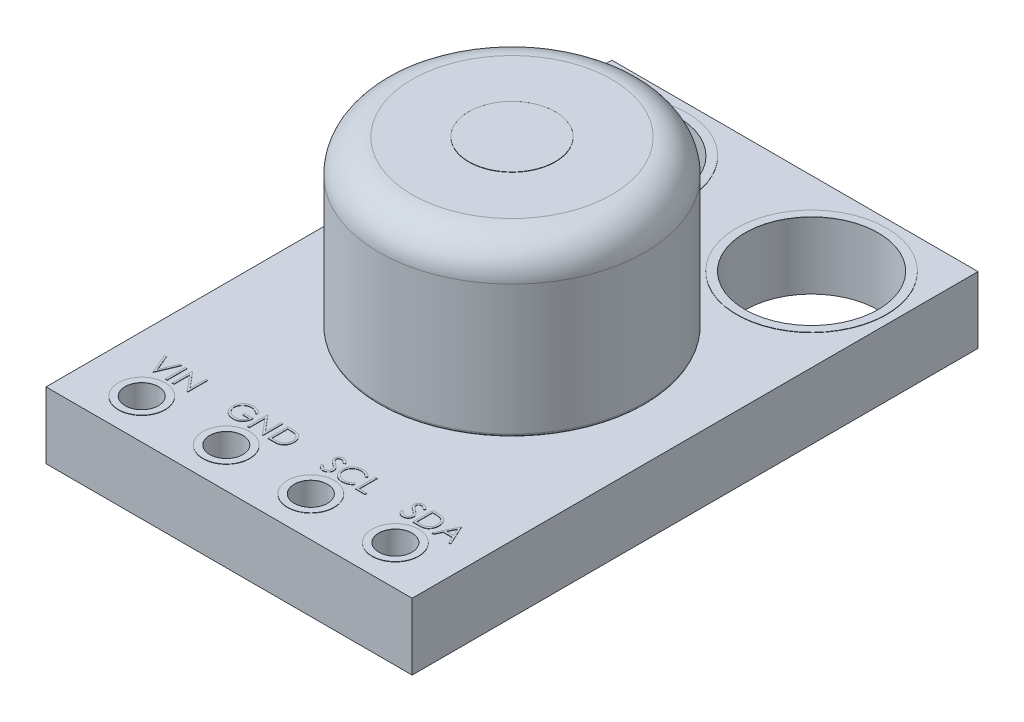
from build123d import *

# Parameters (mm, degrees)
ESBO_O1_W                   = 11
ESBO_O1_H                   = 17
RESSALTO_EXTRUS_O1_DEPTH    = 2
ESBO_O2_R                   = 4
RESSALTO_EXTRUS_O2_DEPTH    = 5
FILETE1_R                   = 1
ESBO_O4_R                   = 1.3
RESSALTO_EXTRUS_O3_DEPTH    = 0.01
ESBO_O5_R                   = 0.7
RESSALTO_EXTRUS_O4_DEPTH    = 0.01
RESSALTO_EXTRUS_O4_2_DEPTH  = 0.01
RESSALTO_EXTRUS_O4_3_DEPTH  = 0.01
RESSALTO_EXTRUS_O4_4_DEPTH  = 0.01
ESBO_O5_R_2                 = 2.25
RESSALTO_EXTRUS_O4_5_DEPTH  = 0.01
RESSALTO_EXTRUS_O4_6_DEPTH  = 0.01
CORTE_EXTRUS_O2_DEPTH       = 25
CORTE_EXTRUS_O2_DEPTH_BACK  = 25
ESBO_O3_R                   = 0.5
ESBO_O3_R_2                 = 2
FILETE3_R                   = 0.1
FILETE4_R                   = 0.001
RESSALTO_EXTRUS_O5_DEPTH    = 0.01
ESBO_O6_W                   = 0.053846154
ESBO_O6_H                   = 0.6
RESSALTO_EXTRUS_O5_2_DEPTH  = 0.01
RESSALTO_EXTRUS_O5_3_DEPTH  = 0.01
RESSALTO_EXTRUS_O5_4_DEPTH  = 0.01
RESSALTO_EXTRUS_O5_5_DEPTH  = 0.01
RESSALTO_EXTRUS_O5_6_DEPTH  = 0.01
RESSALTO_EXTRUS_O5_7_DEPTH  = 0.01
RESSALTO_EXTRUS_O5_8_DEPTH  = 0.01
RESSALTO_EXTRUS_O5_9_DEPTH  = 0.01
RESSALTO_EXTRUS_O5_10_DEPTH = 0.01
RESSALTO_EXTRUS_O5_11_DEPTH = 0.01
RESSALTO_EXTRUS_O5_12_DEPTH = 0.01


with BuildPart() as part:
    # Esboço1 → Ressalto-extrusão1 (new body)
    with BuildSketch(Plane(origin=(0, 0, 0), x_dir=(1, 0, 0), z_dir=(0, 1, 0))):
        with Locations((-7.947204127, -24.039923997)):
            Rectangle(ESBO_O1_W, ESBO_O1_H)
    extrude(amount=RESSALTO_EXTRUS_O1_DEPTH)


with BuildPart() as body_2:
    # Esboço2 → Ressalto-extrusão2 (new body)
    with BuildSketch(Plane(origin=(0, 2, 0), x_dir=(1, 0, 0), z_dir=(0, 1, 0))):
        with Locations(Location((-7.947204127, -24.039923997, 0), (0, 0, 270))):
            Circle(ESBO_O2_R)
    extrude(amount=RESSALTO_EXTRUS_O2_DEPTH)

    # Filete1
    filete1_edges = [body_2.edges().sort_by_distance(p)[0] for p in [
        (-7.947204127, 7, 20.039923997),
    ]]
    fillet(filete1_edges, radius=FILETE1_R)

    # Filete3
    filete3_edges = [body_2.edges().sort_by_distance(p)[0] for p in [
        (-7.947204127, 2, 20.039923997),
    ]]
    fillet(filete3_edges, radius=FILETE3_R)


with BuildPart() as body_3:
    # Esboço4 → Ressalto-extrusão3 (new body)
    with BuildSketch(Plane(origin=(0, 7, 0), x_dir=(1, 0, 0), z_dir=(0, 1, 0))):
        with Locations(Location((-7.947204127, -24.039923997, 0), (0, 0, 90))):
            Circle(ESBO_O4_R)
    extrude(amount=RESSALTO_EXTRUS_O3_DEPTH)

    # Filete4
    filete4_edges = [body_3.edges().sort_by_distance(p)[0] for p in [
        (-7.947204127, 7.01, 25.339923997),
    ]]
    fillet(filete4_edges, radius=FILETE4_R)


with BuildPart() as body_4:
    # Esboço5 → Ressalto-extrusão4 (new body)
    with BuildSketch(Plane(origin=(0, 2, 0), x_dir=(1, 0, 0), z_dir=(0, 1, 0))):
        with Locations(Location((-11.757204127, -31.353461523, 0), (0, 0, 90))):
            Circle(ESBO_O5_R)
    extrude(amount=RESSALTO_EXTRUS_O4_DEPTH)


with BuildPart() as body_5:
    # Esboço5 → Ressalto-extrus_o4 2 (new body)
    with BuildSketch(Plane(origin=(0, 2, 0), x_dir=(1, 0, 0), z_dir=(0, 1, 0))):
        with Locations(Location((-9.217204127, -31.353461523, 0), (0, 0, 90))):
            Circle(ESBO_O5_R)
    extrude(amount=RESSALTO_EXTRUS_O4_2_DEPTH)


with BuildPart() as body_6:
    # Esboço5 → Ressalto-extrus_o4 3 (new body)
    with BuildSketch(Plane(origin=(0, 2, 0), x_dir=(1, 0, 0), z_dir=(0, 1, 0))):
        with Locations(Location((-6.677204127, -31.353461523, 0), (0, 0, 90))):
            Circle(ESBO_O5_R)
    extrude(amount=RESSALTO_EXTRUS_O4_3_DEPTH)


with BuildPart() as body_7:
    # Esboço5 → Ressalto-extrus_o4 4 (new body)
    with BuildSketch(Plane(origin=(0, 2, 0), x_dir=(1, 0, 0), z_dir=(0, 1, 0))):
        with Locations(Location((-4.137204127, -31.353461523, 0), (0, 0, 90))):
            Circle(ESBO_O5_R)
    extrude(amount=RESSALTO_EXTRUS_O4_4_DEPTH)


with BuildPart() as body_8:
    # Esboço5 → Ressalto-extrus_o4 5 (new body)
    with BuildSketch(Plane(origin=(0, 2, 0), x_dir=(1, 0, 0), z_dir=(0, 1, 0))):
        with Locations(Location((-10.947204127, -18.039923997, 0), (0, 0, 90))):
            Circle(ESBO_O5_R_2)
    extrude(amount=RESSALTO_EXTRUS_O4_5_DEPTH)


with BuildPart() as body_9:
    # Esboço5 → Ressalto-extrus_o4 6 (new body)
    with BuildSketch(Plane(origin=(0, 2, 0), x_dir=(1, 0, 0), z_dir=(0, 1, 0))):
        with Locations(Location((-4.947204127, -18.039923997, 0), (0, 0, 90))):
            Circle(ESBO_O5_R_2)
    extrude(amount=RESSALTO_EXTRUS_O4_6_DEPTH)


with BuildPart() as corte_extrus_o2_tool:
    # Esboço3 → Corte-extrusão2 (new, two sides: drawn at the far end of the back side and taken through both)
    with BuildSketch(Plane(origin=(0, 2, 0), x_dir=(1, 0, 0), z_dir=(0, 1, 0)).offset(-CORTE_EXTRUS_O2_DEPTH_BACK)):
        with Locations(Location((-11.757204127, -31.353461523, 0), (0, 0, 270))):
            Circle(ESBO_O3_R)
        with Locations(Location((-9.217204127, -31.353461523, 0), (0, 0, 270))):
            Circle(ESBO_O3_R)
        with Locations(Location((-6.677204127, -31.353461523, 0), (0, 0, 270))):
            Circle(ESBO_O3_R)
        with Locations(Location((-4.137204127, -31.353461523, 0), (0, 0, 270))):
            Circle(ESBO_O3_R)
        with Locations(Location((-10.947204127, -18.039923997, 0), (0, 0, 270))):
            Circle(ESBO_O3_R_2)
        with Locations(Location((-4.947204127, -18.039923997, 0), (0, 0, 270))):
            Circle(ESBO_O3_R_2)
    extrude(amount=CORTE_EXTRUS_O2_DEPTH + CORTE_EXTRUS_O2_DEPTH_BACK)


with BuildPart() as part_1:
    add(part.part)

    # Corte-extrusão2: cut by corte_extrus_o2_tool
    add(corte_extrus_o2_tool.part, mode=Mode.SUBTRACT)


with BuildPart() as body_4_1:
    add(body_4.part)

    # Corte-extrusão2: cut by corte_extrus_o2_tool
    add(corte_extrus_o2_tool.part, mode=Mode.SUBTRACT)


with BuildPart() as body_5_1:
    add(body_5.part)

    # Corte-extrusão2: cut by corte_extrus_o2_tool
    add(corte_extrus_o2_tool.part, mode=Mode.SUBTRACT)


with BuildPart() as body_6_1:
    add(body_6.part)

    # Corte-extrusão2: cut by corte_extrus_o2_tool
    add(corte_extrus_o2_tool.part, mode=Mode.SUBTRACT)


with BuildPart() as body_7_1:
    add(body_7.part)

    # Corte-extrusão2: cut by corte_extrus_o2_tool
    add(corte_extrus_o2_tool.part, mode=Mode.SUBTRACT)


with BuildPart() as body_8_1:
    add(body_8.part)

    # Corte-extrusão2: cut by corte_extrus_o2_tool
    add(corte_extrus_o2_tool.part, mode=Mode.SUBTRACT)


with BuildPart() as body_9_1:
    add(body_9.part)

    # Corte-extrusão2: cut by corte_extrus_o2_tool
    add(corte_extrus_o2_tool.part, mode=Mode.SUBTRACT)


with BuildPart() as body_10:
    # Esboço6 → Ressalto-extrusão5 (new body)
    with BuildSketch(Plane(origin=(0, 2, 0), x_dir=(1, 0, 0), z_dir=(0, 1, 0))):
        Polygon((-12.47271802, -29.953006455), (-12.415025712, -29.953006455), (-12.215025712, -30.425842993), (-12.015025712, -29.953006455), (-11.957333405, -29.953006455), (-12.211179559, -30.553006455), (-12.218871866, -30.553006455), align=None)
    extrude(amount=RESSALTO_EXTRUS_O5_DEPTH)


with BuildPart() as body_11:
    # Esboço6 → Ressalto-extrus_o5 2 (new body)
    with BuildSketch(Plane(origin=(0, 2, 0), x_dir=(1, 0, 0), z_dir=(0, 1, 0))):
        with Locations((-11.82271802, -30.253006455)):
            Rectangle(ESBO_O6_W, ESBO_O6_H)
    extrude(amount=RESSALTO_EXTRUS_O5_2_DEPTH)


with BuildPart() as body_12:
    # Esboço6 → Ressalto-extrus_o5 3 (new body)
    with BuildSketch(Plane(origin=(0, 2, 0), x_dir=(1, 0, 0), z_dir=(0, 1, 0))):
        Polygon((-11.641948789, -30.553006455), (-11.641948789, -29.953006455), (-11.630650712, -29.953006455), (-11.234256482, -30.425242032), (-11.234256482, -29.953006455), (-11.180410328, -29.953006455), (-11.180410328, -30.553006455), (-11.192669943, -30.553006455), (-11.588102635, -30.081852609), (-11.588102635, -30.553006455), align=None)
    extrude(amount=RESSALTO_EXTRUS_O5_3_DEPTH)


with BuildPart() as body_13:
    # Esboço6 → Ressalto-extrus_o5 4 (new body)
    with BuildSketch(Plane(origin=(0, 2, 0), x_dir=(1, 0, 0), z_dir=(0, 1, 0))):
        with BuildLine():
            Line((-9.541948789, -30.055410301), (-9.588102635, -30.099160301))
            add(Edge.make_bspline(
                [(-9.588102635, -30.099160301), (-9.596454445, -30.091303582), (-9.61295891, -30.075777491), (-9.63986638, -30.055632749), (-9.667940146, -30.038375703), (-9.697033717, -30.024334634), (-9.726426612, -30.013131304), (-9.755728688, -30.005155051), (-9.784639379, -30.00006833), (-9.803868045, -29.999460038), (-9.81334302, -29.999160301)],
                knots=[0, 0, 0, 0, 1.08915593, 2.152340314, 3.188132944, 4.216796309, 5.218260357, 6.173443236, 7.099959455, 8, 8, 8, 8], degree=3))
            add(Edge.make_bspline(
                [(-9.81334302, -29.999160301), (-9.819156969, -29.999231205), (-9.830769787, -29.999372829), (-9.848019263, -30.001180408), (-9.86508783, -30.003780099), (-9.881943265, -30.007541564), (-9.898618343, -30.012308832), (-9.915055067, -30.018272054), (-9.931284099, -30.025224381), (-9.94715257, -30.033257948), (-9.962536657, -30.042083065), (-9.9770664, -30.051862815), (-9.990834411, -30.06228375), (-10.003581913, -30.073606775), (-10.015382231, -30.085729323), (-10.026516237, -30.09842589), (-10.036592345, -30.112043356), (-10.045693688, -30.126331178), (-10.053812822, -30.14103841), (-10.06098002, -30.156023494), (-10.066996664, -30.171236726), (-10.071757142, -30.186697197), (-10.075684682, -30.202285298), (-10.078447701, -30.218108964), (-10.080005424, -30.234185139), (-10.080274872, -30.244950383), (-10.080410328, -30.250362224)],
                knots=[0, 0, 0, 0, 1.02818874, 2.053710826, 3.065248034, 4.081641283, 5.106893873, 6.131558223, 7.173050175, 8.228653731, 9.27666206, 10.308777013, 11.325269123, 12.329503258, 13.32196095, 14.316845687, 15.314881793, 16.315733098, 17.311955233, 18.285320748, 19.252783886, 20.203351036, 21.145449891, 22.095197417, 23.042428769, 24, 24, 24, 24], degree=3))
            add(Edge.make_bspline(
                [(-10.080410328, -30.250362224), (-10.080280776, -30.255894364), (-10.080022026, -30.266943538), (-10.078365972, -30.28343395), (-10.075292559, -30.299679448), (-10.071183809, -30.315733414), (-10.066044241, -30.331623342), (-10.059637498, -30.347280343), (-10.052049109, -30.362703839), (-10.0432657, -30.377754859), (-10.03363378, -30.392415949), (-10.022843537, -30.406226153), (-10.011381723, -30.419369372), (-9.998830769, -30.431553788), (-9.985593133, -30.443105313), (-9.971273314, -30.453705688), (-9.956152892, -30.463559098), (-9.940208799, -30.472541359), (-9.923614036, -30.480565679), (-9.906598593, -30.487701204), (-9.88910811, -30.493577662), (-9.871234506, -30.498367051), (-9.852999088, -30.502292816), (-9.834309293, -30.504818384), (-9.815302543, -30.506651098), (-9.802490206, -30.506785099), (-9.796035328, -30.506852609)],
                knots=[0, 0, 0, 0, 0.93586088, 1.869166235, 2.799637598, 3.729985548, 4.670839027, 5.622275134, 6.589130586, 7.576015415, 8.568469353, 9.55398029, 10.53834874, 11.515998671, 12.510579167, 13.508179873, 14.527009472, 15.561807829, 16.601455013, 17.643573243, 18.680854198, 19.719860599, 20.772568776, 21.833555941, 22.908541556, 24, 24, 24, 24], degree=3))
            add(Edge.make_bspline(
                [(-9.796035328, -30.506852609), (-9.788256183, -30.506689996), (-9.772980567, -30.506370678), (-9.750525748, -30.503884914), (-9.728959508, -30.500002607), (-9.708342444, -30.494317025), (-9.688650612, -30.487064966), (-9.669811822, -30.4783229), (-9.651974395, -30.467755518), (-9.635084708, -30.45582857), (-9.619526333, -30.442540313), (-9.605494198, -30.428201263), (-9.593212114, -30.412881023), (-9.582497023, -30.396669826), (-9.573632682, -30.379433488), (-9.566356774, -30.361256478), (-9.560779638, -30.342130618), (-9.558490214, -30.32891491), (-9.557333405, -30.322237224)],
                knots=[0, 0, 0, 0, 1.13008108, 2.219097802, 3.278683437, 4.311054135, 5.322181354, 6.324827112, 7.324222904, 8.330512327, 9.32562643, 10.293043162, 11.24128371, 12.174520618, 13.111833804, 14.052305215, 15.015860969, 16, 16, 16, 16], degree=3))
            Line((-9.557333405, -30.322237224), (-9.757333405, -30.322237224))
            Line((-9.757333405, -30.322237224), (-9.757333405, -30.260698763))
            Line((-9.757333405, -30.260698763), (-9.503487251, -30.260698763))
            add(Edge.make_bspline(
                [(-9.503487251, -30.260698763), (-9.503779682, -30.272168618), (-9.504352023, -30.294617196), (-9.508366694, -30.327354957), (-9.514849525, -30.358275819), (-9.523705578, -30.387412345), (-9.535169912, -30.414723247), (-9.549119488, -30.440236253), (-9.565777566, -30.463786541), (-9.584550784, -30.48556637), (-9.605619349, -30.504994235), (-9.628413969, -30.522069538), (-9.652972307, -30.536452844), (-9.679271131, -30.548154672), (-9.707224348, -30.557287357), (-9.736896642, -30.563762484), (-9.768247773, -30.567641906), (-9.789734061, -30.568137571), (-9.800722828, -30.56839107)],
                knots=[0, 0, 0, 0, 1.140356446, 2.231883559, 3.274166699, 4.278491846, 5.25512956, 6.21435461, 7.1637429, 8.11826594, 9.068280886, 10.0076534, 10.945064095, 11.891975133, 12.864533718, 13.863980011, 14.907571808, 16, 16, 16, 16], degree=3))
            add(Edge.make_bspline(
                [(-9.800722828, -30.56839107), (-9.807495994, -30.568293507), (-9.82085486, -30.56810108), (-9.840584734, -30.566733534), (-9.859770611, -30.564628293), (-9.878409699, -30.561449129), (-9.896570557, -30.557555188), (-9.914162486, -30.552568893), (-9.931252499, -30.546797116), (-9.947867011, -30.540232144), (-9.963855219, -30.532625574), (-9.979288336, -30.524172493), (-9.994251672, -30.514916488), (-10.0086433, -30.504697486), (-10.022538207, -30.493591921), (-10.035846797, -30.481577535), (-10.048643576, -30.468691058), (-10.056659656, -30.45954037), (-10.060698789, -30.454929532)],
                knots=[0, 0, 0, 0, 1.107784379, 2.184907829, 3.233506516, 4.263428166, 5.276301166, 6.270063455, 7.25232949, 8.225834625, 9.190232166, 10.146266622, 11.1027726, 12.066435141, 13.031522626, 14.010570082, 14.99756817, 16, 16, 16, 16], degree=3))
            add(Edge.make_bspline(
                [(-10.060698789, -30.454929532), (-10.066559235, -30.447614563), (-10.078182848, -30.433106045), (-10.093144818, -30.409860341), (-10.105899344, -30.38579145), (-10.116248114, -30.360832371), (-10.124328929, -30.335006449), (-10.130124286, -30.308346685), (-10.133519822, -30.280818748), (-10.134008999, -30.262190417), (-10.134256482, -30.25276607)],
                knots=[0, 0, 0, 0, 1.023165419, 2.029347347, 3.013907458, 3.994755782, 4.975994455, 5.96558838, 6.970761222, 8, 8, 8, 8], degree=3))
            add(Edge.make_bspline(
                [(-10.134256482, -30.25276607), (-10.134165241, -30.245708998), (-10.133983919, -30.231684546), (-10.131785259, -30.210863293), (-10.12863073, -30.190411746), (-10.123994092, -30.170346622), (-10.118149018, -30.15065452), (-10.110854135, -30.131326298), (-10.102360724, -30.112350548), (-10.092488925, -30.093857885), (-10.081503017, -30.0760937), (-10.069580123, -30.059129505), (-10.056550934, -30.043274237), (-10.042628225, -30.028327098), (-10.027645884, -30.014475867), (-10.011744269, -30.001592305), (-9.994911124, -29.98965913), (-9.977093493, -29.978864301), (-9.958557319, -29.969167681), (-9.939347033, -29.960666673), (-9.9194685, -29.953640962), (-9.899070646, -29.947679742), (-9.877999075, -29.943271432), (-9.856406697, -29.940074505), (-9.834180964, -29.937886973), (-9.819157644, -29.937711044), (-9.811540135, -29.937621839)],
                knots=[0, 0, 0, 0, 1.008945113, 2.00506715, 2.99143336, 3.967273523, 4.948097931, 5.927297278, 6.919902385, 7.919676788, 8.923139349, 9.905703106, 10.883022732, 11.856032218, 12.825136022, 13.798837087, 14.781400844, 15.773989409, 16.776158564, 17.77167057, 18.775803737, 19.789618931, 20.80898985, 21.851988756, 22.910860228, 24, 24, 24, 24], degree=3))
            add(Edge.make_bspline(
                [(-9.811540135, -29.937621839), (-9.805327865, -29.937721181), (-9.793009663, -29.937918163), (-9.774679538, -29.939283532), (-9.756632735, -29.941447625), (-9.738842497, -29.944400789), (-9.721369405, -29.948423136), (-9.704163684, -29.953236556), (-9.687200393, -29.958840868), (-9.670532693, -29.965524671), (-9.654048513, -29.973111006), (-9.637656197, -29.98165045), (-9.621411755, -29.991289022), (-9.605287015, -30.002055343), (-9.589180297, -30.0137645), (-9.573346358, -30.026751384), (-9.557402996, -30.040503857), (-9.547151257, -30.050392231), (-9.541948789, -30.055410301)],
                knots=[0, 0, 0, 0, 0.985871117, 1.954866573, 2.915460327, 3.869826059, 4.81536089, 5.759505086, 6.70452669, 7.649098992, 8.607881297, 9.583363685, 10.581137262, 11.603961102, 12.659522466, 13.73993555, 14.853081303, 16, 16, 16, 16], degree=3))
        make_face()
    extrude(amount=RESSALTO_EXTRUS_O5_4_DEPTH)


with BuildPart() as body_14:
    # Esboço6 → Ressalto-extrus_o5 5 (new body)
    with BuildSketch(Plane(origin=(0, 2, 0), x_dir=(1, 0, 0), z_dir=(0, 1, 0))):
        Polygon((-9.380410328, -30.553006455), (-9.380410328, -29.953006455), (-9.369112251, -29.953006455), (-8.97271802, -30.425242032), (-8.97271802, -29.953006455), (-8.918871866, -29.953006455), (-8.918871866, -30.553006455), (-8.931131482, -30.553006455), (-9.326564174, -30.081852609), (-9.326564174, -30.553006455), align=None)
    extrude(amount=RESSALTO_EXTRUS_O5_5_DEPTH)


with BuildPart() as body_15:
    # Esboço6 → Ressalto-extrus_o5 6 (new body)
    with BuildSketch(Plane(origin=(0, 2, 0), x_dir=(1, 0, 0), z_dir=(0, 1, 0))):
        with BuildLine():
            Line((-8.765025712, -30.553006455), (-8.765025712, -29.953006455))
            Line((-8.765025712, -29.953006455), (-8.643871866, -29.953006455))
            add(Edge.make_bspline(
                [(-8.643871866, -29.953006455), (-8.633334325, -29.953082324), (-8.612975851, -29.953228903), (-8.583556575, -29.954158284), (-8.556336501, -29.955802364), (-8.531405154, -29.95819714), (-8.508694089, -29.96113766), (-8.488266899, -29.964823443), (-8.47001796, -29.969175701), (-8.458794627, -29.97288635), (-8.453487251, -29.97464107)],
                knots=[0, 0, 0, 0, 1.314313732, 2.53924729, 3.670748893, 4.714932338, 5.66265055, 6.526160246, 7.303039223, 8, 8, 8, 8], degree=3))
            add(Edge.make_bspline(
                [(-8.453487251, -29.97464107), (-8.446545296, -29.977286334), (-8.432818805, -29.982516876), (-8.413274727, -29.99238367), (-8.394876094, -30.003563059), (-8.37752424, -30.016069779), (-8.361615527, -30.030257953), (-8.346528459, -30.045524882), (-8.332880221, -30.06242574), (-8.320381656, -30.080610024), (-8.309112686, -30.099863518), (-8.299317401, -30.120149537), (-8.291182431, -30.141365058), (-8.284429306, -30.163451084), (-8.279107057, -30.186456177), (-8.275475868, -30.210407125), (-8.273080841, -30.235209272), (-8.272840147, -30.25203918), (-8.27271802, -30.26057857)],
                knots=[0, 0, 0, 0, 0.984719456, 1.947108742, 2.898477687, 3.838006223, 4.779231079, 5.722358779, 6.681677486, 7.655904652, 8.64651281, 9.637519902, 10.640069247, 11.656948941, 12.698408672, 13.768548281, 14.867775369, 16, 16, 16, 16], degree=3))
            add(Edge.make_bspline(
                [(-8.27271802, -30.26057857), (-8.272825843, -30.267994783), (-8.27303832, -30.282609203), (-8.274946202, -30.304147643), (-8.277719286, -30.325047112), (-8.282012577, -30.345208089), (-8.287224436, -30.364807212), (-8.293904005, -30.383635597), (-8.301555804, -30.401865964), (-8.310478641, -30.419251817), (-8.320274307, -30.435723253), (-8.330786606, -30.451250486), (-8.342004325, -30.465611953), (-8.354034433, -30.478851143), (-8.36672147, -30.4909481), (-8.380148498, -30.502003874), (-8.394350164, -30.51180214), (-8.40926286, -30.52072793), (-8.425321625, -30.528514277), (-8.44283063, -30.535102278), (-8.461864546, -30.540561698), (-8.482376653, -30.545116709), (-8.504402392, -30.548729961), (-8.527963358, -30.551151628), (-8.55302335, -30.552789274), (-8.570231225, -30.552932655), (-8.579088212, -30.553006455)],
                knots=[0, 0, 0, 0, 1.105936401, 2.179363191, 3.223086493, 4.248585256, 5.251745608, 6.245858792, 7.225916811, 8.198733463, 9.158002045, 10.082870192, 10.993790845, 11.873723703, 12.748670949, 13.606408763, 14.465103618, 15.319838547, 16.196477973, 17.123216899, 18.106603292, 19.147568657, 20.255746949, 21.433717677, 22.679120308, 24, 24, 24, 24], degree=3))
            Line((-8.579088212, -30.553006455), (-8.765025712, -30.553006455))
        make_face()
        with BuildLine():
            Line((-8.711179559, -30.491467993), (-8.642309366, -30.491467993))
            add(Edge.make_bspline(
                [(-8.642309366, -30.491467993), (-8.632413074, -30.491425462), (-8.61337888, -30.49134366), (-8.586008938, -30.490625854), (-8.561001041, -30.48945295), (-8.53835164, -30.487811508), (-8.518073521, -30.485639746), (-8.500124307, -30.483218334), (-8.484562834, -30.480201628), (-8.475146359, -30.477467178), (-8.470794943, -30.47620357)],
                knots=[0, 0, 0, 0, 1.375205317, 2.645023457, 3.804390687, 4.853969522, 5.800190428, 6.637939096, 7.370582563, 8, 8, 8, 8], degree=3))
            add(Edge.make_bspline(
                [(-8.470794943, -30.47620357), (-8.465318081, -30.474274732), (-8.454495172, -30.470463125), (-8.438915557, -30.463510383), (-8.424385785, -30.455274599), (-8.410652638, -30.446119924), (-8.397910925, -30.435723466), (-8.386009648, -30.424311297), (-8.374972768, -30.411825336), (-8.364914315, -30.398281079), (-8.355912892, -30.383762829), (-8.348117824, -30.368413314), (-8.341286133, -30.352400718), (-8.335924088, -30.335479148), (-8.331721417, -30.317799881), (-8.328744613, -30.299361673), (-8.32689066, -30.280167968), (-8.326674412, -30.267113318), (-8.326564174, -30.260458378)],
                knots=[0, 0, 0, 0, 0.998632004, 1.973411704, 2.929992603, 3.868527914, 4.809262121, 5.754881198, 6.702106254, 7.672490631, 8.653608572, 9.636854334, 10.631411391, 11.644891563, 12.686317036, 13.754757253, 14.855430412, 16, 16, 16, 16], degree=3))
            add(Edge.make_bspline(
                [(-8.326564174, -30.260458378), (-8.326652166, -30.25344121), (-8.326825027, -30.239655921), (-8.328997766, -30.219428945), (-8.33217289, -30.199975119), (-8.336764379, -30.181293143), (-8.342615387, -30.163346568), (-8.349917326, -30.146234652), (-8.358260175, -30.129776674), (-8.368186461, -30.114352497), (-8.379057705, -30.099765107), (-8.391122485, -30.086401407), (-8.40418912, -30.074230956), (-8.418115094, -30.063064217), (-8.433292883, -30.053350444), (-8.449364944, -30.044661298), (-8.466567059, -30.037287146), (-8.47853495, -30.033365055), (-8.484617059, -30.031371839)],
                knots=[0, 0, 0, 0, 1.122418816, 2.205001699, 3.251619955, 4.274784885, 5.280384055, 6.268708349, 7.249350384, 8.229342522, 9.199999885, 10.157847722, 11.105861043, 12.055065948, 13.010012805, 13.98527497, 14.976112212, 16, 16, 16, 16], degree=3))
            add(Edge.make_bspline(
                [(-8.484617059, -30.031371839), (-8.489648684, -30.029980452), (-8.500347299, -30.02702198), (-8.517805493, -30.023794773), (-8.537453804, -30.020948288), (-8.559379467, -30.018538338), (-8.583557489, -30.016809083), (-8.610006464, -30.015511143), (-8.638737825, -30.014635721), (-8.658654831, -30.014575942), (-8.668992059, -30.014544916)],
                knots=[0, 0, 0, 0, 0.674548936, 1.434276114, 2.292660221, 3.240891867, 4.284742987, 5.42552168, 6.663806718, 8, 8, 8, 8], degree=3))
            Line((-8.668992059, -30.014544916), (-8.711179559, -30.014544916))
            Line((-8.711179559, -30.014544916), (-8.711179559, -30.491467993))
        make_face(mode=Mode.SUBTRACT)
    extrude(amount=RESSALTO_EXTRUS_O5_6_DEPTH)


with BuildPart() as body_16:
    # Esboço6 → Ressalto-extrus_o5 7 (new body)
    with BuildSketch(Plane(origin=(0, 2, 0), x_dir=(1, 0, 0), z_dir=(0, 1, 0))):
        with BuildLine():
            Line((-7.288102635, -30.437261263), (-7.237381482, -30.406852609))
            add(Edge.make_bspline(
                [(-7.237381482, -30.406852609), (-7.23266407, -30.41474936), (-7.22362569, -30.429879232), (-7.208548314, -30.450323467), (-7.192925529, -30.467699837), (-7.176641644, -30.481907256), (-7.159796053, -30.493092779), (-7.142278786, -30.501013162), (-7.124148876, -30.505953043), (-7.111810506, -30.506553058), (-7.105650712, -30.506852609)],
                knots=[0, 0, 0, 0, 1.272034388, 2.437168799, 3.508375237, 4.49857839, 5.41946034, 6.295179144, 7.148887113, 8, 8, 8, 8], degree=3))
            add(Edge.make_bspline(
                [(-7.105650712, -30.506852609), (-7.100390108, -30.506706093), (-7.089960947, -30.506415626), (-7.074607419, -30.503624632), (-7.059696253, -30.499336838), (-7.045534772, -30.493196107), (-7.032318381, -30.485766652), (-7.020728662, -30.476793022), (-7.010709328, -30.466746244), (-7.00251348, -30.455537789), (-6.996225474, -30.443483421), (-6.991392548, -30.4311104), (-6.988710536, -30.41822436), (-6.988306521, -30.409548281), (-6.988102635, -30.405169916)],
                knots=[0, 0, 0, 0, 1.095163259, 2.171163733, 3.241058638, 4.321873601, 5.38011039, 6.391990106, 7.366004449, 8.327778327, 9.272591725, 10.192022065, 11.087607919, 12, 12, 12, 12], degree=3))
            add(Edge.make_bspline(
                [(-6.988102635, -30.405169916), (-6.988355374, -30.400174342), (-6.988869156, -30.39001907), (-6.993211695, -30.375036272), (-7.000042995, -30.360208974), (-7.006345162, -30.351037329), (-7.009617059, -30.346275686)],
                knots=[0, 0, 0, 0, 0.938893495, 1.908633276, 2.914225137, 4, 4, 4, 4], degree=3))
            add(Edge.make_bspline(
                [(-7.009617059, -30.346275686), (-7.01230345, -30.342839087), (-7.017943191, -30.335624379), (-7.027638765, -30.324885196), (-7.039015813, -30.313807752), (-7.051684994, -30.301969057), (-7.066107809, -30.28991972), (-7.081832526, -30.277085158), (-7.099260616, -30.26395346), (-7.111483387, -30.255146734), (-7.117790135, -30.250602609)],
                knots=[0, 0, 0, 0, 0.722233717, 1.516239348, 2.393582979, 3.351407094, 4.387010283, 5.505090956, 6.712668013, 8, 8, 8, 8], degree=3))
            add(Edge.make_bspline(
                [(-7.117790135, -30.250602609), (-7.124102821, -30.246106279), (-7.136172194, -30.23750964), (-7.153050808, -30.224751191), (-7.168144144, -30.213086528), (-7.181385119, -30.20240584), (-7.192767907, -30.192707679), (-7.202382206, -30.184085176), (-7.209983101, -30.176305137), (-7.214209772, -30.171258049), (-7.216107443, -30.168992032)],
                knots=[0, 0, 0, 0, 1.452282411, 2.77665338, 3.964542531, 5.026858415, 5.96415736, 6.766646006, 7.446254459, 8, 8, 8, 8], degree=3))
            add(Edge.make_bspline(
                [(-7.216107443, -30.168992032), (-7.218759879, -30.165460425), (-7.223976251, -30.158515048), (-7.230861852, -30.147659358), (-7.23671428, -30.136546798), (-7.241302109, -30.125147507), (-7.245165461, -30.113621519), (-7.247763963, -30.101818448), (-7.24939106, -30.089791257), (-7.249557686, -30.081697514), (-7.249641097, -30.077645878)],
                knots=[0, 0, 0, 0, 1.068054152, 2.10047183, 3.106115577, 4.101338837, 5.06977816, 6.043150881, 7.020423561, 8, 8, 8, 8], degree=3))
            add(Edge.make_bspline(
                [(-7.249641097, -30.077645878), (-7.249417347, -30.071297917), (-7.248974629, -30.058737677), (-7.24523054, -30.040389535), (-7.239320902, -30.022871863), (-7.231041778, -30.006358092), (-7.220369089, -29.991278209), (-7.20801835, -29.977458754), (-7.19330781, -29.965841283), (-7.17716736, -29.955690644), (-7.159500554, -29.947745629), (-7.140987827, -29.941752318), (-7.121599758, -29.938356445), (-7.108467792, -29.937869114), (-7.101804559, -29.937621839)],
                knots=[0, 0, 0, 0, 1.005424448, 1.989358655, 2.955360095, 3.929531133, 4.905563448, 5.876582895, 6.856512386, 7.866279853, 8.892233794, 9.918561126, 10.94386622, 12, 12, 12, 12], degree=3))
            add(Edge.make_bspline(
                [(-7.101804559, -29.937621839), (-7.094734141, -29.937865705), (-7.080673338, -29.938350677), (-7.059990616, -29.942567397), (-7.04007735, -29.949544655), (-7.024058504, -29.95746271), (-7.01152146, -29.965370953), (-7.00196042, -29.972574352), (-6.992271714, -29.980867227), (-6.98237719, -29.990271669), (-6.972444506, -30.00087397), (-6.9623262, -30.012601516), (-6.951998611, -30.02538264), (-6.945354749, -30.03450684), (-6.941948789, -30.039184339)],
                knots=[0, 0, 0, 0, 1.286793592, 2.559021753, 3.825965368, 5.121522368, 5.803751409, 6.523245864, 7.299691795, 8.125521123, 9.008227632, 9.944561021, 10.946284179, 12, 12, 12, 12], degree=3))
            Line((-6.941948789, -30.039184339), (-6.990626674, -30.076083378))
            add(Edge.make_bspline(
                [(-6.990626674, -30.076083378), (-6.993565977, -30.072296745), (-6.999226386, -30.065004576), (-7.007820013, -30.054792351), (-7.015919781, -30.045463811), (-7.023899849, -30.037361218), (-7.031338758, -30.030040852), (-7.038558822, -30.023773465), (-7.045456139, -30.018497649), (-7.054150467, -30.012867324), (-7.065073504, -30.007286209), (-7.078785139, -30.00256351), (-7.093114215, -29.9997255), (-7.10287358, -29.999350262), (-7.107814174, -29.999160301)],
                knots=[0, 0, 0, 0, 1.181633172, 2.275549214, 3.290209073, 4.226197932, 5.078386478, 5.862611352, 6.581680152, 7.217281963, 8.414376989, 9.595101626, 10.782541182, 12, 12, 12, 12], degree=3))
            add(Edge.make_bspline(
                [(-7.107814174, -29.999160301), (-7.114012435, -29.999368021), (-7.125965197, -29.999768589), (-7.142934952, -30.004143444), (-7.158208196, -30.011031763), (-7.171331493, -30.020685759), (-7.182257832, -30.032123644), (-7.190161625, -30.045285733), (-7.194918796, -30.059819859), (-7.195499301, -30.069958429), (-7.195794943, -30.075121839)],
                knots=[0, 0, 0, 0, 1.14458467, 2.207223713, 3.21896685, 4.227309161, 5.202851033, 6.127160689, 7.046193047, 8, 8, 8, 8], degree=3))
            add(Edge.make_bspline(
                [(-7.195794943, -30.075121839), (-7.19572755, -30.078336379), (-7.195592654, -30.084770713), (-7.19371126, -30.094276671), (-7.191294232, -30.103758615), (-7.187464066, -30.113173915), (-7.1821763, -30.122687234), (-7.175232556, -30.132462389), (-7.166487416, -30.142585539), (-7.1597885, -30.14916966), (-7.156251674, -30.152645878)],
                knots=[0, 0, 0, 0, 0.858281714, 1.717966888, 2.583508476, 3.4729293, 4.427298488, 5.488583878, 6.674047936, 8, 8, 8, 8], degree=3))
            add(Edge.make_bspline(
                [(-7.156251674, -30.152645878), (-7.154938296, -30.153817939), (-7.15181801, -30.156602489), (-7.146113566, -30.161161166), (-7.138580514, -30.166784499), (-7.129415566, -30.173742324), (-7.118449732, -30.181813432), (-7.105681808, -30.190894623), (-7.091254117, -30.201280701), (-7.081016074, -30.208541994), (-7.075602635, -30.212381455)],
                knots=[0, 0, 0, 0, 0.420754252, 0.999615792, 1.744751191, 2.668019286, 3.750313428, 4.999500688, 6.413464383, 8, 8, 8, 8], degree=3))
            add(Edge.make_bspline(
                [(-7.075602635, -30.212381455), (-7.069090765, -30.217119974), (-7.056481429, -30.226295458), (-7.03854013, -30.240081004), (-7.02227262, -30.253563478), (-7.007621785, -30.266656782), (-6.994442886, -30.279261598), (-6.982882134, -30.291529572), (-6.972821732, -30.303372813), (-6.961991009, -30.318556683), (-6.950923954, -30.337204869), (-6.941419696, -30.360052567), (-6.935426836, -30.382989079), (-6.934643148, -30.398405108), (-6.934256482, -30.406011263)],
                knots=[0, 0, 0, 0, 1.163667725, 2.253281268, 3.268753668, 4.215851969, 5.092017293, 5.902905408, 6.650798638, 7.335211899, 8.59617414, 9.77448103, 10.901945474, 12, 12, 12, 12], degree=3))
            add(Edge.make_bspline(
                [(-6.934256482, -30.406011263), (-6.934369134, -30.411390411), (-6.934592251, -30.422044248), (-6.937156979, -30.437687975), (-6.940914636, -30.452881839), (-6.946578162, -30.46743803), (-6.953490703, -30.481622846), (-6.96226206, -30.4950642), (-6.972429091, -30.508059583), (-6.984092023, -30.520262467), (-6.996854177, -30.531464672), (-7.010342811, -30.541429654), (-7.02458, -30.54973851), (-7.039488512, -30.556518654), (-7.055071769, -30.561821543), (-7.071324532, -30.565663749), (-7.088273591, -30.568021871), (-7.099793674, -30.56826663), (-7.105650712, -30.56839107)],
                knots=[0, 0, 0, 0, 0.983748083, 1.948392443, 2.894712957, 3.844097841, 4.80183111, 5.778335162, 6.776009319, 7.81870978, 8.863265674, 9.881300176, 10.883814829, 11.87499822, 12.874611388, 13.892143829, 14.928324115, 16, 16, 16, 16], degree=3))
            add(Edge.make_bspline(
                [(-7.105650712, -30.56839107), (-7.110182485, -30.568303439), (-7.119188959, -30.56812928), (-7.132510584, -30.566589632), (-7.145563085, -30.564411272), (-7.158182676, -30.56095286), (-7.170531947, -30.556756807), (-7.182557187, -30.551590235), (-7.194264225, -30.545398715), (-7.205718668, -30.538319568), (-7.216891383, -30.530081097), (-7.227677578, -30.520485641), (-7.238431152, -30.50979784), (-7.248834706, -30.497727458), (-7.259098674, -30.484469501), (-7.269020687, -30.469899926), (-7.278806124, -30.454098094), (-7.284945919, -30.442978365), (-7.288102635, -30.437261263)],
                knots=[0, 0, 0, 0, 0.915332311, 1.819136955, 2.706846663, 3.586547465, 4.459518054, 5.340707479, 6.227863349, 7.133153174, 8.059268498, 9.028702269, 10.047606654, 11.120612155, 12.245963614, 13.433783089, 14.680604001, 16, 16, 16, 16], degree=3))
        make_face()
    extrude(amount=RESSALTO_EXTRUS_O5_7_DEPTH)


with BuildPart() as body_17:
    # Esboço6 → Ressalto-extrus_o5 8 (new body)
    with BuildSketch(Plane(origin=(0, 2, 0), x_dir=(1, 0, 0), z_dir=(0, 1, 0))):
        with BuildLine():
            Line((-6.257333405, -30.063102609), (-6.304448789, -30.099160301))
            add(Edge.make_bspline(
                [(-6.304448789, -30.099160301), (-6.307809799, -30.095154706), (-6.314486504, -30.087197521), (-6.325228081, -30.076023884), (-6.336422649, -30.065555554), (-6.348065927, -30.05574266), (-6.36036749, -30.046928358), (-6.373029341, -30.038653311), (-6.386263292, -30.031235985), (-6.404563589, -30.02224233), (-6.42850322, -30.012857275), (-6.458639479, -30.00498815), (-6.490098524, -29.999978805), (-6.51156097, -29.999436261), (-6.522477635, -29.999160301)],
                knots=[0, 0, 0, 0, 0.757959112, 1.505699292, 2.245454638, 2.979532153, 3.711538275, 4.438200793, 5.171680507, 5.909471876, 7.393775596, 8.890124382, 10.418191784, 12, 12, 12, 12], degree=3))
            add(Edge.make_bspline(
                [(-6.522477635, -29.999160301), (-6.528491915, -29.999229552), (-6.540464657, -29.99936741), (-6.558232967, -30.001186118), (-6.57566949, -30.003742325), (-6.592762884, -30.007535238), (-6.609491391, -30.012330544), (-6.625964374, -30.018060615), (-6.641943334, -30.025150016), (-6.657649318, -30.032985717), (-6.672697183, -30.041836137), (-6.686935191, -30.051489854), (-6.700311414, -30.061838842), (-6.712836433, -30.072921889), (-6.724523053, -30.084689082), (-6.735286592, -30.097265826), (-6.745089805, -30.110611913), (-6.754127009, -30.124551354), (-6.762220621, -30.139043547), (-6.768997172, -30.154142131), (-6.77499805, -30.169588549), (-6.779746491, -30.185557319), (-6.78350498, -30.201936079), (-6.786098294, -30.218768785), (-6.787896317, -30.236020273), (-6.78803349, -30.247713298), (-6.788102635, -30.253607416)],
                knots=[0, 0, 0, 0, 1.054917814, 2.100044995, 3.131103042, 4.146048494, 5.169673617, 6.183595914, 7.203665975, 8.234915748, 9.262203917, 10.264457458, 11.251630812, 12.227803204, 13.197192746, 14.159520551, 15.12972552, 16.100847026, 17.073214652, 18.039054194, 19.002613845, 19.979014051, 20.95965708, 21.949030935, 22.966165397, 24, 24, 24, 24], degree=3))
            add(Edge.make_bspline(
                [(-6.788102635, -30.253607416), (-6.787886324, -30.262475643), (-6.787461624, -30.279887229), (-6.78368191, -30.305390762), (-6.77793818, -30.329822877), (-6.769329795, -30.35303085), (-6.758715101, -30.375300855), (-6.745302424, -30.396256087), (-6.729768161, -30.416213212), (-6.711892546, -30.434700574), (-6.692280121, -30.451588642), (-6.671237621, -30.46646017), (-6.648817458, -30.478857007), (-6.625267178, -30.489172883), (-6.600405559, -30.497102608), (-6.574277307, -30.502685029), (-6.546939251, -30.506326546), (-6.528258782, -30.506675178), (-6.518751674, -30.506852609)],
                knots=[0, 0, 0, 0, 1.029171465, 2.020641659, 2.987623507, 3.938342917, 4.889210282, 5.84687017, 6.821220943, 7.821438502, 8.827599549, 9.822697543, 10.807740252, 11.797342354, 12.80366471, 13.83203677, 14.896651826, 16, 16, 16, 16], degree=3))
            add(Edge.make_bspline(
                [(-6.518751674, -30.506852609), (-6.508276927, -30.506563104), (-6.48766012, -30.505993288), (-6.457425601, -30.501165988), (-6.428482327, -30.493338917), (-6.400828741, -30.482384987), (-6.374542801, -30.468145224), (-6.349583374, -30.45088273), (-6.32592939, -30.430433302), (-6.311705742, -30.414819051), (-6.304448789, -30.406852609)],
                knots=[0, 0, 0, 0, 1.028121516, 2.023589091, 2.998037872, 3.967518031, 4.937445131, 5.927275754, 6.942489185, 8, 8, 8, 8], degree=3))
            Line((-6.304448789, -30.406852609), (-6.257333405, -30.442549724))
            add(Edge.make_bspline(
                [(-6.257333405, -30.442549724), (-6.261125081, -30.44744203), (-6.268690271, -30.457203208), (-6.280940216, -30.470964073), (-6.293844896, -30.483907622), (-6.307500161, -30.4959295), (-6.321748925, -30.507270265), (-6.336847036, -30.517607722), (-6.352596013, -30.527086159), (-6.368942495, -30.535765061), (-6.385869114, -30.54346516), (-6.403355589, -30.550057235), (-6.421326544, -30.555735787), (-6.439782803, -30.560407548), (-6.458762647, -30.564054019), (-6.478197585, -30.566491678), (-6.498129564, -30.56816172), (-6.511576665, -30.568313934), (-6.518391097, -30.56839107)],
                knots=[0, 0, 0, 0, 0.986787822, 1.968848986, 2.935600012, 3.899624008, 4.868462664, 5.837806735, 6.815139263, 7.798259679, 8.787526145, 9.778297419, 10.776456485, 11.791383307, 12.812564526, 13.85620153, 14.913611965, 16, 16, 16, 16], degree=3))
            add(Edge.make_bspline(
                [(-6.518391097, -30.56839107), (-6.524844297, -30.568346157), (-6.537604701, -30.568257347), (-6.556444487, -30.56681869), (-6.574785558, -30.564855878), (-6.592575494, -30.561900427), (-6.609911375, -30.558412826), (-6.626636047, -30.553737753), (-6.642914083, -30.548500753), (-6.658680084, -30.542345613), (-6.673947461, -30.535399981), (-6.688666972, -30.52755), (-6.702831846, -30.51886168), (-6.716581347, -30.509526536), (-6.729712361, -30.499244712), (-6.74233868, -30.488159004), (-6.754531104, -30.476306773), (-6.762074422, -30.467760227), (-6.765867059, -30.463463186)],
                knots=[0, 0, 0, 0, 1.114604814, 2.203992996, 3.262667896, 4.300477797, 5.318619304, 6.316056647, 7.298880507, 8.271930387, 9.238335007, 10.195173496, 11.151986948, 12.108099108, 13.064862484, 14.031167946, 15.010108607, 16, 16, 16, 16], degree=3))
            add(Edge.make_bspline(
                [(-6.765867059, -30.463463186), (-6.77194174, -30.455998982), (-6.784017765, -30.441160689), (-6.799467882, -30.417111663), (-6.812693177, -30.392002827), (-6.823386192, -30.365702268), (-6.831745518, -30.338269002), (-6.83753658, -30.309689199), (-6.841299712, -30.279989552), (-6.841730047, -30.25978896), (-6.841948789, -30.249520878)],
                knots=[0, 0, 0, 0, 0.994628077, 1.977248131, 2.950237994, 3.925870899, 4.908910175, 5.911660606, 6.938484602, 8, 8, 8, 8], degree=3))
            add(Edge.make_bspline(
                [(-6.841948789, -30.249520878), (-6.841682185, -30.238728514), (-6.841157657, -30.217495213), (-6.836701235, -30.186333964), (-6.829532298, -30.156479438), (-6.819349974, -30.127987368), (-6.806440486, -30.100707891), (-6.790493066, -30.074849399), (-6.771692985, -30.050246519), (-6.750187687, -30.027272562), (-6.726604716, -30.006265816), (-6.701350062, -29.987784752), (-6.674473157, -29.972404606), (-6.646270096, -29.959548121), (-6.616529694, -29.949666214), (-6.585315402, -29.942748524), (-6.552685874, -29.938442733), (-6.530423743, -29.937898412), (-6.519112251, -29.937621839)],
                knots=[0, 0, 0, 0, 1.032925535, 2.032216505, 3.007276963, 3.968222605, 4.92396291, 5.891752235, 6.871517503, 7.883894988, 8.900124299, 9.891468569, 10.874487609, 11.85992873, 12.854644235, 13.869047385, 14.917252991, 16, 16, 16, 16], degree=3))
            add(Edge.make_bspline(
                [(-6.519112251, -29.937621839), (-6.512218341, -29.937704492), (-6.498572542, -29.937868094), (-6.478386373, -29.939463432), (-6.458733403, -29.942122908), (-6.439600091, -29.945742805), (-6.420893357, -29.950235489), (-6.402756173, -29.956088111), (-6.385082112, -29.962780088), (-6.367982642, -29.970487254), (-6.351539805, -29.979138695), (-6.335758722, -29.988638516), (-6.320764746, -29.99897494), (-6.306452372, -30.010060056), (-6.293061022, -30.02212838), (-6.280210483, -30.034847968), (-6.268337155, -30.048585195), (-6.261008036, -30.058254613), (-6.257333405, -30.063102609)],
                knots=[0, 0, 0, 0, 1.096760587, 2.17092713, 3.219439832, 4.250915756, 5.268269357, 6.278326846, 7.281116186, 8.274029601, 9.260640565, 10.235837813, 11.203064059, 12.156899882, 13.114053108, 14.069676657, 15.032185724, 16, 16, 16, 16], degree=3))
        make_face()
    extrude(amount=RESSALTO_EXTRUS_O5_8_DEPTH)


with BuildPart() as body_18:
    # Esboço6 → Ressalto-extrus_o5 9 (new body)
    with BuildSketch(Plane(origin=(0, 2, 0), x_dir=(1, 0, 0), z_dir=(0, 1, 0))):
        Polygon((-6.134256482, -29.953006455), (-6.080410328, -29.953006455), (-6.080410328, -30.491467993), (-5.849641097, -30.491467993), (-5.849641097, -30.553006455), (-6.134256482, -30.553006455), align=None)
    extrude(amount=RESSALTO_EXTRUS_O5_9_DEPTH)


with BuildPart() as body_19:
    # Esboço6 → Ressalto-extrus_o5 10 (new body)
    with BuildSketch(Plane(origin=(0, 2, 0), x_dir=(1, 0, 0), z_dir=(0, 1, 0))):
        with BuildLine():
            Line((-4.888102635, -30.437261263), (-4.837381482, -30.406852609))
            add(Edge.make_bspline(
                [(-4.837381482, -30.406852609), (-4.83266407, -30.41474936), (-4.82362569, -30.429879232), (-4.808548314, -30.450323467), (-4.792925529, -30.467699837), (-4.776641644, -30.481907256), (-4.759796053, -30.493092779), (-4.742278786, -30.501013162), (-4.724148876, -30.505953043), (-4.711810506, -30.506553058), (-4.705650712, -30.506852609)],
                knots=[0, 0, 0, 0, 1.272034388, 2.437168799, 3.508375237, 4.49857839, 5.41946034, 6.295179144, 7.148887113, 8, 8, 8, 8], degree=3))
            add(Edge.make_bspline(
                [(-4.705650712, -30.506852609), (-4.700390108, -30.506706093), (-4.689960947, -30.506415626), (-4.674607419, -30.503624632), (-4.659696253, -30.499336838), (-4.645534772, -30.493196107), (-4.632318381, -30.485766652), (-4.620728662, -30.476793022), (-4.610709328, -30.466746244), (-4.60251348, -30.455537789), (-4.596225474, -30.443483421), (-4.591392548, -30.4311104), (-4.588710536, -30.41822436), (-4.588306521, -30.409548281), (-4.588102635, -30.405169916)],
                knots=[0, 0, 0, 0, 1.095163259, 2.171163733, 3.241058638, 4.321873601, 5.38011039, 6.391990106, 7.366004449, 8.327778327, 9.272591725, 10.192022065, 11.087607919, 12, 12, 12, 12], degree=3))
            add(Edge.make_bspline(
                [(-4.588102635, -30.405169916), (-4.588355374, -30.400174342), (-4.588869156, -30.39001907), (-4.593211695, -30.375036272), (-4.600042995, -30.360208974), (-4.606345162, -30.351037329), (-4.609617059, -30.346275686)],
                knots=[0, 0, 0, 0, 0.938893495, 1.908633276, 2.914225137, 4, 4, 4, 4], degree=3))
            add(Edge.make_bspline(
                [(-4.609617059, -30.346275686), (-4.61230345, -30.342839087), (-4.617943191, -30.335624379), (-4.627638765, -30.324885196), (-4.639015813, -30.313807752), (-4.651684994, -30.301969057), (-4.666107809, -30.28991972), (-4.681832526, -30.277085158), (-4.699260616, -30.26395346), (-4.711483387, -30.255146734), (-4.717790135, -30.250602609)],
                knots=[0, 0, 0, 0, 0.722233717, 1.516239348, 2.393582979, 3.351407094, 4.387010283, 5.505090956, 6.712668013, 8, 8, 8, 8], degree=3))
            add(Edge.make_bspline(
                [(-4.717790135, -30.250602609), (-4.724102821, -30.246106279), (-4.736172194, -30.23750964), (-4.753050808, -30.224751191), (-4.768144144, -30.213086528), (-4.781385119, -30.20240584), (-4.792767907, -30.192707679), (-4.802382206, -30.184085176), (-4.809983101, -30.176305137), (-4.814209772, -30.171258049), (-4.816107443, -30.168992032)],
                knots=[0, 0, 0, 0, 1.452282411, 2.77665338, 3.964542531, 5.026858415, 5.96415736, 6.766646006, 7.446254459, 8, 8, 8, 8], degree=3))
            add(Edge.make_bspline(
                [(-4.816107443, -30.168992032), (-4.818759879, -30.165460425), (-4.823976251, -30.158515048), (-4.830861852, -30.147659358), (-4.83671428, -30.136546798), (-4.841302109, -30.125147507), (-4.845165461, -30.113621519), (-4.847763963, -30.101818448), (-4.84939106, -30.089791257), (-4.849557686, -30.081697514), (-4.849641097, -30.077645878)],
                knots=[0, 0, 0, 0, 1.068054152, 2.10047183, 3.106115577, 4.101338837, 5.06977816, 6.043150881, 7.020423561, 8, 8, 8, 8], degree=3))
            add(Edge.make_bspline(
                [(-4.849641097, -30.077645878), (-4.849417347, -30.071297917), (-4.848974629, -30.058737677), (-4.84523054, -30.040389535), (-4.839320902, -30.022871863), (-4.831041778, -30.006358092), (-4.820369089, -29.991278209), (-4.80801835, -29.977458754), (-4.79330781, -29.965841283), (-4.77716736, -29.955690644), (-4.759500554, -29.947745629), (-4.740987827, -29.941752318), (-4.721599758, -29.938356445), (-4.708467792, -29.937869114), (-4.701804559, -29.937621839)],
                knots=[0, 0, 0, 0, 1.005424448, 1.989358655, 2.955360095, 3.929531133, 4.905563448, 5.876582895, 6.856512386, 7.866279853, 8.892233794, 9.918561126, 10.94386622, 12, 12, 12, 12], degree=3))
            add(Edge.make_bspline(
                [(-4.701804559, -29.937621839), (-4.694734141, -29.937865705), (-4.680673338, -29.938350677), (-4.659990616, -29.942567397), (-4.64007735, -29.949544655), (-4.624058504, -29.95746271), (-4.61152146, -29.965370953), (-4.60196042, -29.972574352), (-4.592271714, -29.980867227), (-4.58237719, -29.990271669), (-4.572444506, -30.00087397), (-4.5623262, -30.012601516), (-4.551998611, -30.02538264), (-4.545354749, -30.03450684), (-4.541948789, -30.039184339)],
                knots=[0, 0, 0, 0, 1.286793592, 2.559021753, 3.825965368, 5.121522368, 5.803751409, 6.523245864, 7.299691795, 8.125521123, 9.008227632, 9.944561021, 10.946284179, 12, 12, 12, 12], degree=3))
            Line((-4.541948789, -30.039184339), (-4.590626674, -30.076083378))
            add(Edge.make_bspline(
                [(-4.590626674, -30.076083378), (-4.593565977, -30.072296745), (-4.599226386, -30.065004576), (-4.607820013, -30.054792351), (-4.615919781, -30.045463811), (-4.623899849, -30.037361218), (-4.631338758, -30.030040852), (-4.638558822, -30.023773465), (-4.645456139, -30.018497649), (-4.654150467, -30.012867324), (-4.665073504, -30.007286209), (-4.678785139, -30.00256351), (-4.693114215, -29.9997255), (-4.70287358, -29.999350262), (-4.707814174, -29.999160301)],
                knots=[0, 0, 0, 0, 1.181633172, 2.275549214, 3.290209073, 4.226197932, 5.078386478, 5.862611352, 6.581680152, 7.217281963, 8.414376989, 9.595101626, 10.782541182, 12, 12, 12, 12], degree=3))
            add(Edge.make_bspline(
                [(-4.707814174, -29.999160301), (-4.714012435, -29.999368021), (-4.725965197, -29.999768589), (-4.742934952, -30.004143444), (-4.758208196, -30.011031763), (-4.771331493, -30.020685759), (-4.782257832, -30.032123644), (-4.790161625, -30.045285733), (-4.794918796, -30.059819859), (-4.795499301, -30.069958429), (-4.795794943, -30.075121839)],
                knots=[0, 0, 0, 0, 1.14458467, 2.207223713, 3.21896685, 4.227309161, 5.202851033, 6.127160689, 7.046193047, 8, 8, 8, 8], degree=3))
            add(Edge.make_bspline(
                [(-4.795794943, -30.075121839), (-4.79572755, -30.078336379), (-4.795592654, -30.084770713), (-4.79371126, -30.094276671), (-4.791294232, -30.103758615), (-4.787464066, -30.113173915), (-4.7821763, -30.122687234), (-4.775232556, -30.132462389), (-4.766487416, -30.142585539), (-4.7597885, -30.14916966), (-4.756251674, -30.152645878)],
                knots=[0, 0, 0, 0, 0.858281714, 1.717966888, 2.583508476, 3.4729293, 4.427298488, 5.488583878, 6.674047936, 8, 8, 8, 8], degree=3))
            add(Edge.make_bspline(
                [(-4.756251674, -30.152645878), (-4.754938296, -30.153817939), (-4.75181801, -30.156602489), (-4.746113566, -30.161161166), (-4.738580514, -30.166784499), (-4.729415566, -30.173742324), (-4.718449732, -30.181813432), (-4.705681808, -30.190894623), (-4.691254117, -30.201280701), (-4.681016074, -30.208541994), (-4.675602635, -30.212381455)],
                knots=[0, 0, 0, 0, 0.420754252, 0.999615792, 1.744751191, 2.668019286, 3.750313428, 4.999500688, 6.413464383, 8, 8, 8, 8], degree=3))
            add(Edge.make_bspline(
                [(-4.675602635, -30.212381455), (-4.669090765, -30.217119974), (-4.656481429, -30.226295458), (-4.63854013, -30.240081004), (-4.62227262, -30.253563478), (-4.607621785, -30.266656782), (-4.594442886, -30.279261598), (-4.582882134, -30.291529572), (-4.572821732, -30.303372813), (-4.561991009, -30.318556683), (-4.550923954, -30.337204869), (-4.541419696, -30.360052567), (-4.535426836, -30.382989079), (-4.534643148, -30.398405108), (-4.534256482, -30.406011263)],
                knots=[0, 0, 0, 0, 1.163667725, 2.253281268, 3.268753668, 4.215851969, 5.092017293, 5.902905408, 6.650798638, 7.335211899, 8.59617414, 9.77448103, 10.901945474, 12, 12, 12, 12], degree=3))
            add(Edge.make_bspline(
                [(-4.534256482, -30.406011263), (-4.534369134, -30.411390411), (-4.534592251, -30.422044248), (-4.537156979, -30.437687975), (-4.540914636, -30.452881839), (-4.546578162, -30.46743803), (-4.553490703, -30.481622846), (-4.56226206, -30.4950642), (-4.572429091, -30.508059583), (-4.584092023, -30.520262467), (-4.596854177, -30.531464672), (-4.610342811, -30.541429654), (-4.62458, -30.54973851), (-4.639488512, -30.556518654), (-4.655071769, -30.561821543), (-4.671324532, -30.565663749), (-4.688273591, -30.568021871), (-4.699793674, -30.56826663), (-4.705650712, -30.56839107)],
                knots=[0, 0, 0, 0, 0.983748083, 1.948392443, 2.894712957, 3.844097841, 4.80183111, 5.778335162, 6.776009319, 7.81870978, 8.863265674, 9.881300176, 10.883814829, 11.87499822, 12.874611388, 13.892143829, 14.928324115, 16, 16, 16, 16], degree=3))
            add(Edge.make_bspline(
                [(-4.705650712, -30.56839107), (-4.710182485, -30.568303439), (-4.719188959, -30.56812928), (-4.732510584, -30.566589632), (-4.745563085, -30.564411272), (-4.758182676, -30.56095286), (-4.770531947, -30.556756807), (-4.782557187, -30.551590235), (-4.794264225, -30.545398715), (-4.805718668, -30.538319568), (-4.816891383, -30.530081097), (-4.827677578, -30.520485641), (-4.838431152, -30.50979784), (-4.848834706, -30.497727458), (-4.859098674, -30.484469501), (-4.869020687, -30.469899926), (-4.878806124, -30.454098094), (-4.884945919, -30.442978365), (-4.888102635, -30.437261263)],
                knots=[0, 0, 0, 0, 0.915332311, 1.819136955, 2.706846663, 3.586547465, 4.459518054, 5.340707479, 6.227863349, 7.133153174, 8.059268498, 9.028702269, 10.047606654, 11.120612155, 12.245963614, 13.433783089, 14.680604001, 16, 16, 16, 16], degree=3))
        make_face()
    extrude(amount=RESSALTO_EXTRUS_O5_10_DEPTH)


with BuildPart() as body_20:
    # Esboço6 → Ressalto-extrus_o5 11 (new body)
    with BuildSketch(Plane(origin=(0, 2, 0), x_dir=(1, 0, 0), z_dir=(0, 1, 0))):
        with BuildLine():
            Line((-4.411179559, -30.553006455), (-4.411179559, -29.953006455))
            Line((-4.411179559, -29.953006455), (-4.290025712, -29.953006455))
            add(Edge.make_bspline(
                [(-4.290025712, -29.953006455), (-4.279488172, -29.953082324), (-4.259129698, -29.953228903), (-4.229710421, -29.954158284), (-4.202490347, -29.955802364), (-4.177559, -29.95819714), (-4.154847935, -29.96113766), (-4.134420745, -29.964823443), (-4.116171806, -29.969175701), (-4.104948474, -29.97288635), (-4.099641097, -29.97464107)],
                knots=[0, 0, 0, 0, 1.314313732, 2.53924729, 3.670748893, 4.714932338, 5.66265055, 6.526160246, 7.303039223, 8, 8, 8, 8], degree=3))
            add(Edge.make_bspline(
                [(-4.099641097, -29.97464107), (-4.092699142, -29.977286334), (-4.078972652, -29.982516876), (-4.059428573, -29.99238367), (-4.04102994, -30.003563059), (-4.023678086, -30.016069779), (-4.007769373, -30.030257953), (-3.992682305, -30.045524882), (-3.979034067, -30.06242574), (-3.966535502, -30.080610024), (-3.955266532, -30.099863518), (-3.945471247, -30.120149537), (-3.937336277, -30.141365058), (-3.930583153, -30.163451084), (-3.925260903, -30.186456177), (-3.921629714, -30.210407125), (-3.919234688, -30.235209272), (-3.918993993, -30.25203918), (-3.918871866, -30.26057857)],
                knots=[0, 0, 0, 0, 0.984719456, 1.947108742, 2.898477687, 3.838006223, 4.779231079, 5.722358779, 6.681677486, 7.655904652, 8.64651281, 9.637519902, 10.640069247, 11.656948941, 12.698408672, 13.768548281, 14.867775369, 16, 16, 16, 16], degree=3))
            add(Edge.make_bspline(
                [(-3.918871866, -30.26057857), (-3.918979689, -30.267994783), (-3.919192166, -30.282609203), (-3.921100048, -30.304147643), (-3.923873132, -30.325047112), (-3.928166423, -30.345208089), (-3.933378282, -30.364807212), (-3.940057851, -30.383635597), (-3.947709651, -30.401865964), (-3.956632487, -30.419251817), (-3.966428153, -30.435723253), (-3.976940452, -30.451250486), (-3.988158171, -30.465611953), (-4.000188279, -30.478851143), (-4.012875316, -30.4909481), (-4.026302345, -30.502003874), (-4.04050401, -30.51180214), (-4.055416706, -30.52072793), (-4.071475471, -30.528514277), (-4.088984476, -30.535102278), (-4.108018393, -30.540561698), (-4.1285305, -30.545116709), (-4.150556239, -30.548729961), (-4.174117204, -30.551151628), (-4.199177197, -30.552789274), (-4.216385071, -30.552932655), (-4.225242059, -30.553006455)],
                knots=[0, 0, 0, 0, 1.105936401, 2.179363191, 3.223086493, 4.248585256, 5.251745608, 6.245858792, 7.225916811, 8.198733463, 9.158002045, 10.082870192, 10.993790845, 11.873723703, 12.748670949, 13.606408763, 14.465103618, 15.319838547, 16.196477973, 17.123216899, 18.106603292, 19.147568657, 20.255746949, 21.433717677, 22.679120308, 24, 24, 24, 24], degree=3))
            Line((-4.225242059, -30.553006455), (-4.411179559, -30.553006455))
        make_face()
        with BuildLine():
            Line((-4.357333405, -30.491467993), (-4.288463212, -30.491467993))
            add(Edge.make_bspline(
                [(-4.288463212, -30.491467993), (-4.27856692, -30.491425462), (-4.259532726, -30.49134366), (-4.232162784, -30.490625854), (-4.207154887, -30.48945295), (-4.184505486, -30.487811508), (-4.164227367, -30.485639746), (-4.146278153, -30.483218334), (-4.13071668, -30.480201628), (-4.121300205, -30.477467178), (-4.116948789, -30.47620357)],
                knots=[0, 0, 0, 0, 1.375205317, 2.645023457, 3.804390687, 4.853969522, 5.800190428, 6.637939096, 7.370582563, 8, 8, 8, 8], degree=3))
            add(Edge.make_bspline(
                [(-4.116948789, -30.47620357), (-4.111471927, -30.474274732), (-4.100649018, -30.470463125), (-4.085069403, -30.463510383), (-4.070539631, -30.455274599), (-4.056806484, -30.446119924), (-4.044064771, -30.435723466), (-4.032163494, -30.424311297), (-4.021126614, -30.411825336), (-4.011068161, -30.398281079), (-4.002066738, -30.383762829), (-3.99427167, -30.368413314), (-3.987439979, -30.352400718), (-3.982077934, -30.335479148), (-3.977875263, -30.317799881), (-3.974898459, -30.299361673), (-3.973044506, -30.280167968), (-3.972828258, -30.267113318), (-3.97271802, -30.260458378)],
                knots=[0, 0, 0, 0, 0.998632004, 1.973411704, 2.929992603, 3.868527914, 4.809262121, 5.754881198, 6.702106254, 7.672490631, 8.653608572, 9.636854334, 10.631411391, 11.644891563, 12.686317036, 13.754757253, 14.855430412, 16, 16, 16, 16], degree=3))
            add(Edge.make_bspline(
                [(-3.97271802, -30.260458378), (-3.972806012, -30.25344121), (-3.972978874, -30.239655921), (-3.975151612, -30.219428945), (-3.978326736, -30.199975119), (-3.982918225, -30.181293143), (-3.988769233, -30.163346568), (-3.996071172, -30.146234652), (-4.004414021, -30.129776674), (-4.014340307, -30.114352497), (-4.025211552, -30.099765107), (-4.037276331, -30.086401407), (-4.050342966, -30.074230956), (-4.06426894, -30.063064217), (-4.079446729, -30.053350444), (-4.09551879, -30.044661298), (-4.112720905, -30.037287146), (-4.124688796, -30.033365055), (-4.130770905, -30.031371839)],
                knots=[0, 0, 0, 0, 1.122418816, 2.205001699, 3.251619955, 4.274784885, 5.280384055, 6.268708349, 7.249350384, 8.229342522, 9.199999885, 10.157847722, 11.105861043, 12.055065948, 13.010012805, 13.98527497, 14.976112212, 16, 16, 16, 16], degree=3))
            add(Edge.make_bspline(
                [(-4.130770905, -30.031371839), (-4.13580253, -30.029980452), (-4.146501145, -30.02702198), (-4.163959339, -30.023794773), (-4.18360765, -30.020948288), (-4.205533313, -30.018538338), (-4.229711335, -30.016809083), (-4.25616031, -30.015511143), (-4.284891671, -30.014635721), (-4.304808677, -30.014575942), (-4.315145905, -30.014544916)],
                knots=[0, 0, 0, 0, 0.674548936, 1.434276114, 2.292660221, 3.240891867, 4.284742987, 5.42552168, 6.663806718, 8, 8, 8, 8], degree=3))
            Line((-4.315145905, -30.014544916), (-4.357333405, -30.014544916))
            Line((-4.357333405, -30.014544916), (-4.357333405, -30.491467993))
        make_face(mode=Mode.SUBTRACT)
    extrude(amount=RESSALTO_EXTRUS_O5_11_DEPTH)


with BuildPart() as body_21:
    # Esboço6 → Ressalto-extrus_o5 12 (new body)
    with BuildSketch(Plane(origin=(0, 2, 0), x_dir=(1, 0, 0), z_dir=(0, 1, 0))):
        Polygon((-3.549641097, -29.953006455), (-3.27271802, -30.553006455), (-3.331251674, -30.553006455), (-3.419953597, -30.360698763), (-3.691948789, -30.360698763), (-3.783174751, -30.553006455), (-3.841948789, -30.553006455), (-3.557333405, -29.953006455), align=None)
        Polygon((-3.554088212, -30.06995357), (-3.662742059, -30.299160301), (-3.448318982, -30.299160301), align=None, mode=Mode.SUBTRACT)
    extrude(amount=RESSALTO_EXTRUS_O5_12_DEPTH)


solid = Compound([body_2.part, body_3.part, part_1.part, body_4_1.part, body_5_1.part, body_6_1.part, body_7_1.part, body_8_1.part, body_9_1.part, body_10.part, body_11.part, body_12.part, body_13.part, body_14.part, body_15.part, body_16.part, body_17.part, body_18.part, body_19.part, body_20.part, body_21.part])
